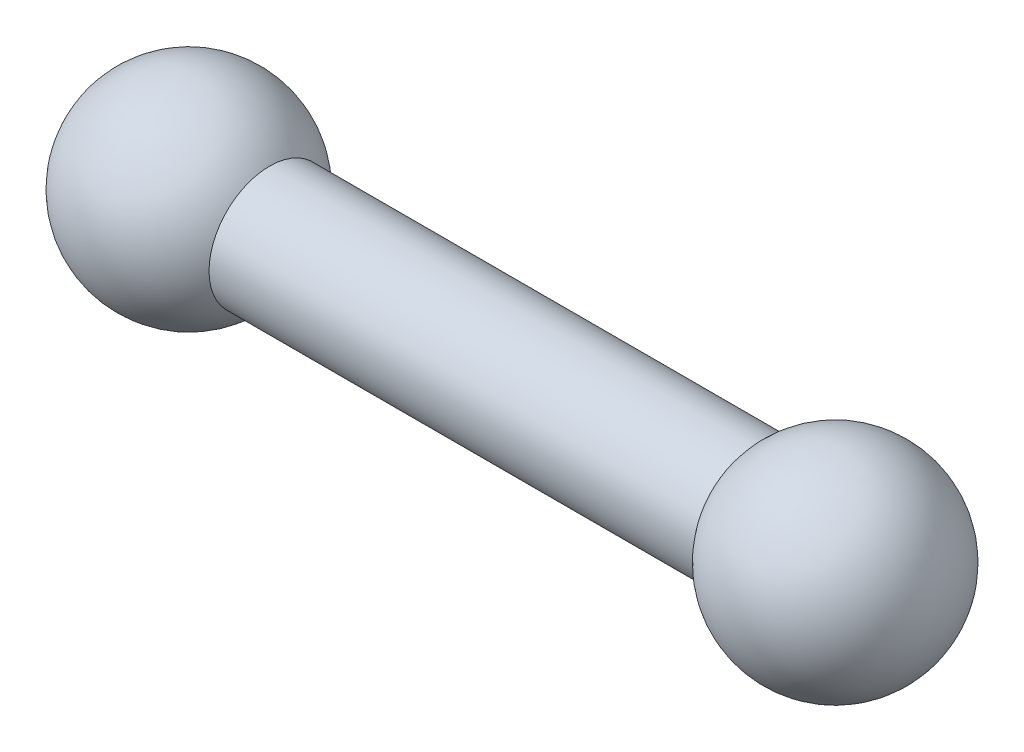
from build123d import *


with BuildPart() as part:
    # Sketch1 → Revolve1 (revolve)
    with BuildSketch(Plane.XY):
        with BuildLine():
            Line((-2.5, 0), (18.5, 0))
            ThreePointArc((18.5, 0), (16.790569415, 2.371708245), (14, 1.5))
            Line((14, 1.5), (2, 1.5))
            ThreePointArc((2, 1.5), (-0.790569415, 2.371708245), (-2.5, 0))
        make_face()
    revolve(axis=Axis((-2.5, 0, 0), (1, 0, 0)))


solid = part.part
